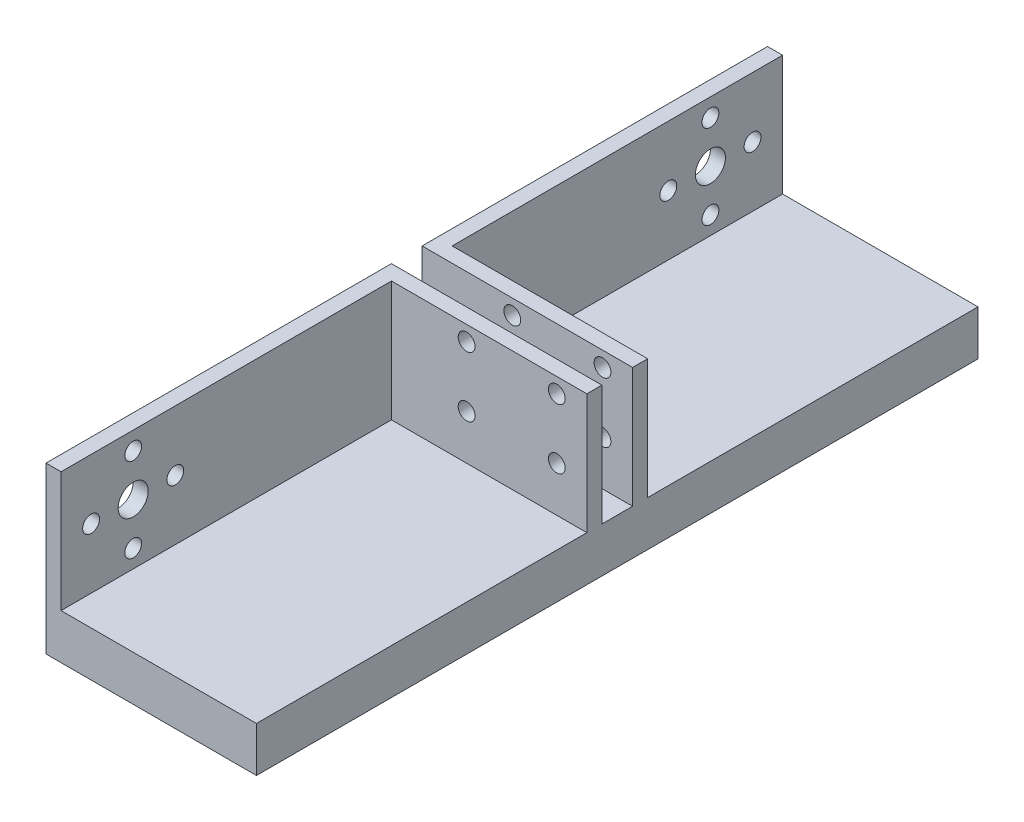
from build123d import *

# Parameters (mm, degrees)
SKETCH1_W           = 35
SKETCH1_H           = 120
BOSS_EXTRUDE1_DEPTH = 7.5
BOSS_EXTRUDE2_DEPTH = 20
SKETCH4_R           = 1.4
CUT_EXTRUDE2_DEPTH  = 12
SKETCH5_R           = 2.5
SKETCH5_R_2         = 1.4
CUT_EXTRUDE3_DEPTH  = 2.5


with BuildPart() as part:
    # Sketch1 → Boss-Extrude1 (new body)
    with BuildSketch(Plane(origin=(0, 0, 0), x_dir=(1, 0, 0), z_dir=(0, 1, 0))):
        with Locations((-17.5, 0)):
            Rectangle(SKETCH1_W, SKETCH1_H)
    extrude(amount=BOSS_EXTRUDE1_DEPTH)

    # Sketch2 → Boss-Extrude2 (add)
    with BuildSketch(Plane(origin=(0, 7.5, 0), x_dir=(1, 0, 0), z_dir=(0, 1, 0))):
        Polygon((0, 5.05), (-32.5, 5.05), (-32.5, 60), (-35, 60), (-35, 2.55), (0, 2.55), align=None)
        Polygon((0, -5.05), (0, -2.55), (-35, -2.55), (-35, -60), (-32.5, -60), (-32.5, -5.05), align=None)
    extrude(amount=BOSS_EXTRUDE2_DEPTH)

    # Sketch4 → Cut-Extrude2 (cut)
    with BuildSketch(Plane.XY.offset(5.05)):
        with Locations(Location((-5, 25, 0), (0, 0, 180))):
            Circle(SKETCH4_R)
        with Locations(Location((-20, 25, 0), (0, 0, 180))):
            Circle(SKETCH4_R)
        with Locations(Location((-5, 15, 0), (0, 0, 180))):
            Circle(SKETCH4_R)
        with Locations(Location((-20, 15, 0), (0, 0, 180))):
            Circle(SKETCH4_R)
    extrude(amount=-CUT_EXTRUDE2_DEPTH, mode=Mode.SUBTRACT)

    # Sketch5 → Cut-Extrude3 (cut)
    with BuildSketch(Plane(origin=(-32.5, 0, 0), x_dir=(0, 0, -1), z_dir=(1, 0, 0))):
        with Locations((-48, 17.5)):
            Circle(SKETCH5_R)
        with Locations((-48, 24.5)):
            Circle(SKETCH5_R_2)
        with Locations((-55, 17.5)):
            Circle(SKETCH5_R_2)
        with Locations(Location((-48, 10.5, 0), (0, 0, 180))):
            Circle(SKETCH5_R_2)
        with Locations(Location((-41, 17.5, 0), (0, 0, 180))):
            Circle(SKETCH5_R_2)
        with Locations((41, 17.5)):
            Circle(SKETCH5_R_2)
        with Locations((48, 10.5)):
            Circle(SKETCH5_R_2)
        with Locations(Location((55, 17.5, 0), (0, 0, 180))):
            Circle(SKETCH5_R_2)
        with Locations(Location((48, 24.5, 0), (0, 0, 180))):
            Circle(SKETCH5_R_2)
        with Locations(Location((48, 17.5, 0), (0, 0, 180))):
            Circle(SKETCH5_R)
    extrude(amount=-CUT_EXTRUDE3_DEPTH, mode=Mode.SUBTRACT)


solid = part.part
